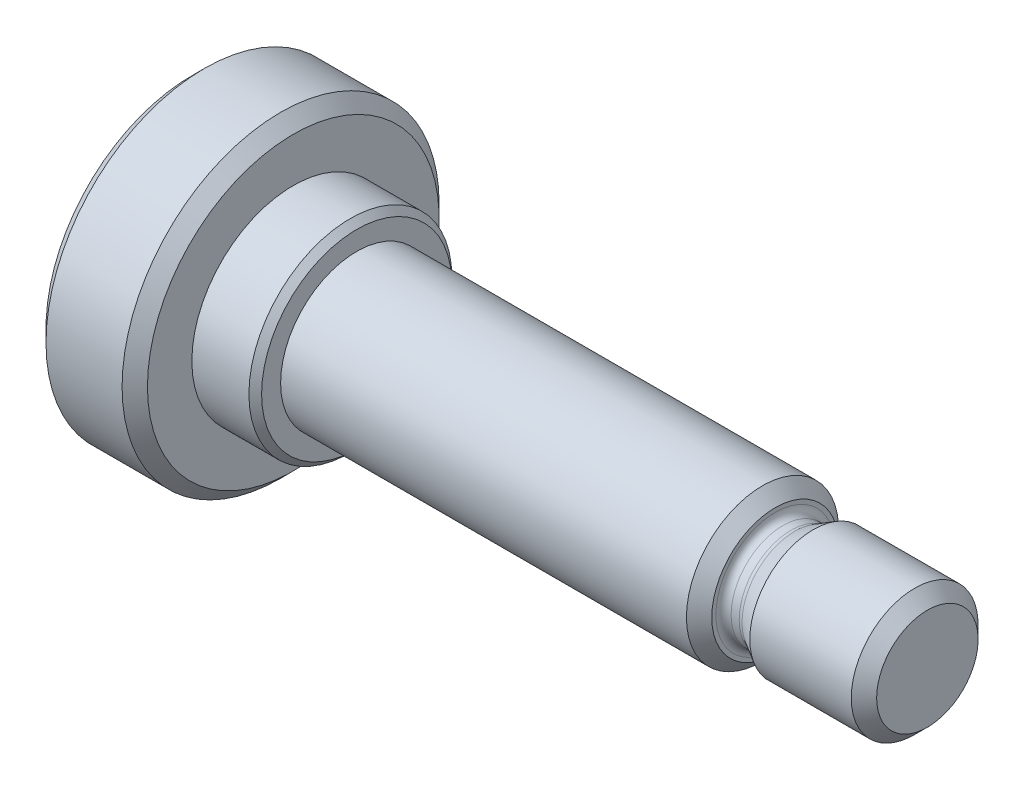
from build123d import *

# Parameters (mm, degrees)
CHAMFER1_SIZE = 1
FILLET1_R     = 0.6
CHAMFER3_SIZE = 1
CHAMFER4_SIZE = 0.5


with BuildPart() as part:
    # Sketch1 → Revolve1 (revolve)
    with BuildSketch(Plane.XY, mode=Mode.PRIVATE) as revolve1_sk:
        Polygon((0, 0), (0, 12.5), (8, 12.5), (8, 8), (13, 8), (13, 6), (46, 6), (46, 4.076239569), (47.4, 4.076239569), (49, 5), (58, 5), (58, 0), align=None)
    revolve(revolve1_sk.sketch.rotate(Axis((-9.676136096, 0, 0), (1, 0, 0)), 90), axis=Axis((-9.676136096, 0, 0), (1, 0, 0)))

    # Chamfer1
    chamfer1_edges = [part.edges().sort_by_distance(p)[0] for p in [
        (46, 0, -6),
        (8, 0, -12.5),
        (0, 0, -12.5),
    ]]
    chamfer(chamfer1_edges, length=CHAMFER1_SIZE)

    # Fillet1
    fillet1_edges = [part.edges().sort_by_distance(p)[0] for p in [
        (47.4, 0, -4.076239569),
        (46, 0, -4.076239569),
    ]]
    fillet(fillet1_edges, radius=FILLET1_R)

    # Chamfer3
    chamfer3_edges = [part.edges().sort_by_distance(p)[0] for p in [
        (58, 0, -5),
    ]]
    chamfer(chamfer3_edges, length=CHAMFER3_SIZE)

    # Chamfer4
    chamfer4_edges = [part.edges().sort_by_distance(p)[0] for p in [
        (13, 0, -8),
    ]]
    chamfer(chamfer4_edges, length=CHAMFER4_SIZE)


solid = part.part
